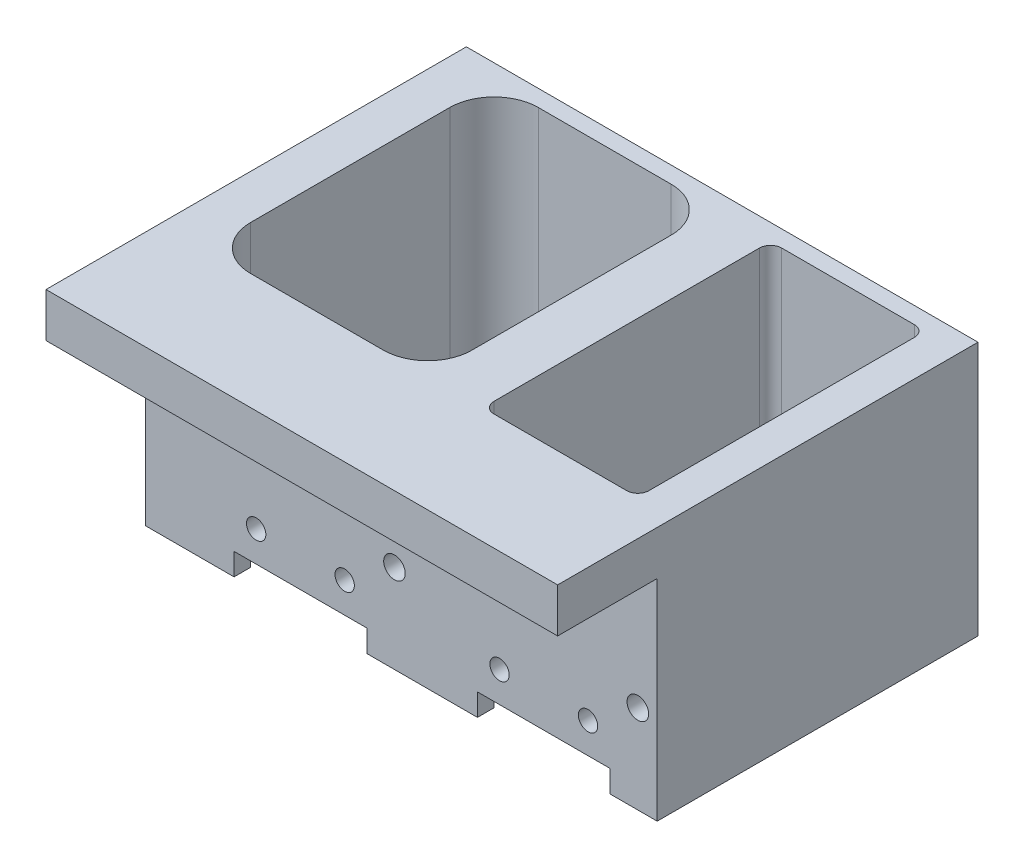
from build123d import *

# Parameters (mm, degrees)
SKETCH1_W                  = 405
SKETCH1_H                  = 295
BOSS_EXTRUDE1_DEPTH        = 53
SKETCH3_OUTSIDE_W          = 507.768
SKETCH3_OUTSIDE_H          = 397.768
SKETCH3_OUTSIDE_W_2        = 369
SKETCH3_OUTSIDE_H_2        = 259
CUT_EXTRUDE2_DEPTH         = 45
MINI_BIN_CUTS_DEPTH        = 46
FILLET1_R                  = 8
SKETCH6_W                  = 259
SKETCH6_H                  = 7
CUT_EXTRUDE5_DEPTH         = 418.533531588
SKETCH8_R                  = 1.75
SKETCH8_R_2                = 1.95
HOLES_LIDS_8_9_12_13_DEPTH = 3
SKETCH9_W                  = 113
SKETCH9_H                  = 46
SKETCH9_W_2                = 199.5
CUT_EXTRUDE6_DEPTH         = 362.718467872
SKETCH10_W                 = 219
SKETCH10_H                 = 46
CUT_EXTRUDE7_DEPTH         = 182.993131739
CUT_EXTRUDE8_REACH         = 121.093
SKETCH11_W                 = 24
SKETCH11_H                 = 4


with BuildPart() as part:
    # Sketch1 → Boss-Extrude1 (new body)
    with BuildSketch(Plane(origin=(0, 0, 0), x_dir=(1, 0, 0), z_dir=(0, 1, 0))):
        Rectangle(SKETCH1_W, SKETCH1_H)
    extrude(amount=BOSS_EXTRUDE1_DEPTH)

    # Sketch3 outside → Cut-Extrude2 (cut)
    with BuildSketch(Plane(origin=(0, 0, 0), x_dir=(-1, 0, 0), z_dir=(0, -1, 0))):
        Rectangle(SKETCH3_OUTSIDE_W, SKETCH3_OUTSIDE_H)
        Rectangle(SKETCH3_OUTSIDE_W_2, SKETCH3_OUTSIDE_H_2, mode=Mode.SUBTRACT)
    extrude(amount=-CUT_EXTRUDE2_DEPTH, mode=Mode.SUBTRACT)

    # Sketch2 → Mini bin cuts (cut)
    with BuildSketch(Plane(origin=(0, 53, 0), x_dir=(1, 0, 0), z_dir=(0, 1, 0))):
        with BuildLine():
            Line((-173.5, -126.5), (-105.5, -126.5))
            ThreePointArc((-105.5, -126.5), (-99.843145751, -124.156854249), (-97.5, -118.5))
            Line((-97.5, -118.5), (-97.5, -49.5))
            ThreePointArc((-97.5, -49.5), (-99.843145751, -43.843145751), (-105.5, -41.5))
            Line((-105.5, -41.5), (-173.5, -41.5))
            ThreePointArc((-173.5, -41.5), (-179.156854249, -43.843145751), (-181.5, -49.5))
            Line((-181.5, -49.5), (-181.5, -118.5))
            ThreePointArc((-181.5, -118.5), (-179.156854249, -124.156854249), (-173.5, -126.5))
        make_face()
        with BuildLine():
            Line((-173.5, -31.5), (-105.5, -31.5))
            ThreePointArc((-105.5, -31.5), (-99.843145751, -29.156854249), (-97.5, -23.5))
            Line((-97.5, -23.5), (-97.5, 40.5))
            ThreePointArc((-97.5, 40.5), (-99.843145751, 46.156854249), (-105.5, 48.5))
            Line((-105.5, 48.5), (-173.5, 48.5))
            ThreePointArc((-173.5, 48.5), (-179.156854249, 46.156854249), (-181.5, 40.5))
            Line((-181.5, 40.5), (-181.5, -23.5))
            ThreePointArc((-181.5, -23.5), (-179.156854249, -29.156854249), (-173.5, -31.5))
        make_face()
        with BuildLine():
            Line((-173.5, 126.5), (-105.5, 126.5))
            ThreePointArc((-105.5, 126.5), (-99.843145751, 124.156854249), (-97.5, 118.5))
            Line((-97.5, 118.5), (-97.5, 66.5))
            ThreePointArc((-97.5, 66.5), (-99.843145751, 60.843145751), (-105.5, 58.5))
            Line((-105.5, 58.5), (-173.5, 58.5))
            ThreePointArc((-173.5, 58.5), (-179.156854249, 60.843145751), (-181.5, 66.5))
            Line((-181.5, 66.5), (-181.5, 118.5))
            ThreePointArc((-181.5, 118.5), (-179.156854249, 124.156854249), (-173.5, 126.5))
        make_face()
        with BuildLine():
            Line((173.5, -126.5), (115.5, -126.5))
            ThreePointArc((115.5, -126.5), (109.843145751, -124.156854249), (107.5, -118.5))
            Line((107.5, -118.5), (107.5, 7.5))
            ThreePointArc((107.5, 7.5), (109.843145751, 13.156854249), (115.5, 15.5))
            Line((115.5, 15.5), (173.5, 15.5))
            ThreePointArc((173.5, 15.5), (179.156854249, 13.156854249), (181.5, 7.5))
            Line((181.5, 7.5), (181.5, -118.5))
            ThreePointArc((181.5, -118.5), (179.156854249, -124.156854249), (173.5, -126.5))
        make_face()
        with BuildLine():
            Line((173.5, 126.5), (107.5, 126.5))
            ThreePointArc((107.5, 126.5), (101.843145751, 124.156854249), (99.5, 118.5))
            Line((99.5, 118.5), (99.5, 33.5))
            ThreePointArc((99.5, 33.5), (101.843145751, 27.843145751), (107.5, 25.5))
            Line((107.5, 25.5), (173.5, 25.5))
            ThreePointArc((173.5, 25.5), (179.156854249, 27.843145751), (181.5, 33.5))
            Line((181.5, 33.5), (181.5, 118.5))
            ThreePointArc((181.5, 118.5), (179.156854249, 124.156854249), (173.5, 126.5))
        make_face()
        with BuildLine():
            Line((81.5, 126.5), (20.5, 126.5))
            ThreePointArc((20.5, 126.5), (14.843145751, 124.156854249), (12.5, 118.5))
            Line((12.5, 118.5), (12.5, -7.5))
            ThreePointArc((12.5, -7.5), (14.843145751, -13.156854249), (20.5, -15.5))
            Line((20.5, -15.5), (81.5, -15.5))
            ThreePointArc((81.5, -15.5), (87.156854249, -13.156854249), (89.5, -7.5))
            Line((89.5, -7.5), (89.5, 118.5))
            ThreePointArc((89.5, 118.5), (87.156854249, 124.156854249), (81.5, 126.5))
        make_face()
        with BuildLine():
            Line((-9.5, 126.5), (-31.5, 126.5))
            ThreePointArc((-31.5, 126.5), (-37.156854249, 124.156854249), (-39.5, 118.5))
            Line((-39.5, 118.5), (-39.5, 11.5))
            ThreePointArc((-39.5, 11.5), (-37.156854249, 5.843145751), (-31.5, 3.5))
            Line((-31.5, 3.5), (-9.5, 3.5))
            ThreePointArc((-9.5, 3.5), (-3.843145751, 5.843145751), (-1.5, 11.5))
            Line((-1.5, 11.5), (-1.5, 118.5))
            ThreePointArc((-1.5, 118.5), (-3.843145751, 124.156854249), (-9.5, 126.5))
        make_face()
        with BuildLine():
            Line((-57.5, 126.5), (-79.5, 126.5))
            ThreePointArc((-79.5, 126.5), (-85.156854249, 124.156854249), (-87.5, 118.5))
            Line((-87.5, 118.5), (-87.5, 11.5))
            ThreePointArc((-87.5, 11.5), (-85.156854249, 5.843145751), (-79.5, 3.5))
            Line((-79.5, 3.5), (-57.5, 3.5))
            ThreePointArc((-57.5, 3.5), (-51.843145751, 5.843145751), (-49.5, 11.5))
            Line((-49.5, 11.5), (-49.5, 118.5))
            ThreePointArc((-49.5, 118.5), (-51.843145751, 124.156854249), (-57.5, 126.5))
        make_face()
        with BuildLine():
            Line((-79.5, -15.5), (-55.5, -15.5))
            ThreePointArc((-55.5, -15.5), (-54.085786438, -16.085786438), (-53.5, -17.5))
            Line((-53.5, -17.5), (-53.5, -65.5))
            ThreePointArc((-53.5, -65.5), (-54.085786438, -66.914213562), (-55.5, -67.5))
            Line((-55.5, -67.5), (-79.5, -67.5))
            ThreePointArc((-79.5, -67.5), (-80.914213562, -66.914213562), (-81.5, -65.5))
            Line((-81.5, -65.5), (-81.5, -17.5))
            ThreePointArc((-81.5, -17.5), (-80.914213562, -16.085786438), (-79.5, -15.5))
        make_face()
        with BuildLine():
            Line((-73.5, -126.5), (-49.5, -126.5))
            ThreePointArc((-49.5, -126.5), (-43.843145751, -124.156854249), (-41.5, -118.5))
            Line((-41.5, -118.5), (-41.5, -82.5))
            ThreePointArc((-41.5, -82.5), (-43.843145751, -76.843145751), (-49.5, -74.5))
            Line((-49.5, -74.5), (-73.5, -74.5))
            ThreePointArc((-73.5, -74.5), (-79.156854249, -76.843145751), (-81.5, -82.5))
            Line((-81.5, -82.5), (-81.5, -118.5))
            ThreePointArc((-81.5, -118.5), (-79.156854249, -124.156854249), (-73.5, -126.5))
        make_face()
        with BuildLine():
            Line((-35.5, -15.5), (-11.5, -15.5))
            ThreePointArc((-11.5, -15.5), (-5.843145751, -17.843145751), (-3.5, -23.5))
            Line((-3.5, -23.5), (-3.5, -59.5))
            ThreePointArc((-3.5, -59.5), (-5.843145751, -65.156854249), (-11.5, -67.5))
            Line((-11.5, -67.5), (-35.5, -67.5))
            ThreePointArc((-35.5, -67.5), (-41.156854249, -65.156854249), (-43.5, -59.5))
            Line((-43.5, -59.5), (-43.5, -23.5))
            ThreePointArc((-43.5, -23.5), (-41.156854249, -17.843145751), (-35.5, -15.5))
        make_face()
        with BuildLine():
            Line((-29.5, -74.5), (-5.5, -74.5))
            ThreePointArc((-5.5, -74.5), (-4.085786438, -75.085786438), (-3.5, -76.5))
            Line((-3.5, -76.5), (-3.5, -124.5))
            ThreePointArc((-3.5, -124.5), (-4.085786438, -125.914213562), (-5.5, -126.5))
            Line((-5.5, -126.5), (-29.5, -126.5))
            ThreePointArc((-29.5, -126.5), (-30.914213562, -125.914213562), (-31.5, -124.5))
            Line((-31.5, -124.5), (-31.5, -76.5))
            ThreePointArc((-31.5, -76.5), (-30.914213562, -75.085786438), (-29.5, -74.5))
        make_face()
        with BuildLine():
            Line((89.5, -126.5), (19.5, -126.5))
            ThreePointArc((19.5, -126.5), (13.843145751, -124.156854249), (11.5, -118.5))
            Line((11.5, -118.5), (11.5, -33.5))
            ThreePointArc((11.5, -33.5), (13.843145751, -27.843145751), (19.5, -25.5))
            Line((19.5, -25.5), (89.5, -25.5))
            ThreePointArc((89.5, -25.5), (95.156854249, -27.843145751), (97.5, -33.5))
            Line((97.5, -33.5), (97.5, -118.5))
            ThreePointArc((97.5, -118.5), (95.156854249, -124.156854249), (89.5, -126.5))
        make_face()
    extrude(amount=-MINI_BIN_CUTS_DEPTH, mode=Mode.SUBTRACT)

    # Fillet1
    fillet1_edges = [part.edges().sort_by_distance(p)[0] for p in [
        (184.5, 22.5, 129.5),
        (184.5, 22.5, -129.5),
        (-184.5, 22.5, -129.5),
        (-184.5, 22.5, 129.5),
    ]]
    fillet(fillet1_edges, radius=FILLET1_R)

    # Sketch6 → Cut-Extrude5 (cut, through all)
    with BuildSketch(Plane.ZY.offset(184.5)):
        with Locations((0, 3.5)):
            Rectangle(SKETCH6_W, SKETCH6_H)
    extrude(amount=-CUT_EXTRUDE5_DEPTH, mode=Mode.SUBTRACT)

    # Sketch8 → Holes Lids 8,9,12,13 (cut)
    with BuildSketch(Plane.XY.offset(129.5)):
        with Locations((-69.5, 16.5)):
            Circle(SKETCH8_R)
        with Locations((-25.5, 16.5)):
            Circle(SKETCH8_R)
        with Locations((46.5, 16.5)):
            Circle(SKETCH8_R)
        with Locations((136.5, 16.5)):
            Circle(SKETCH8_R)
        with Locations((152.5, 16.5)):
            Circle(SKETCH8_R)
        with Locations((62.5, 16.5)):
            Circle(SKETCH8_R)
        with Locations((-9.5, 16.5)):
            Circle(SKETCH8_R)
        with Locations((-53.5, 16.5)):
            Circle(SKETCH8_R)
        with Locations((-44.5, 23)):
            Circle(SKETCH8_R_2)
        with Locations((-0.5, 23)):
            Circle(SKETCH8_R_2)
        with Locations((71.5, 23)):
            Circle(SKETCH8_R_2)
        with Locations((161.5, 23)):
            Circle(SKETCH8_R_2)
    extrude(amount=-HOLES_LIDS_8_9_12_13_DEPTH, mode=Mode.SUBTRACT)

    # Sketch9 → Cut-Extrude6 (cut, through all)
    with BuildSketch(Plane.XY.offset(147.5)):
        with Locations((-146, 30)):
            Rectangle(SKETCH9_W, SKETCH9_H)
        with Locations((102.75, 30)):
            Rectangle(SKETCH9_W_2, SKETCH9_H)
    extrude(amount=-CUT_EXTRUDE6_DEPTH, mode=Mode.SUBTRACT)

    # Sketch10 → Cut-Extrude7 (cut, through all)
    with BuildSketch(Plane(origin=(3, 0, 0), x_dir=(0, 0, -1), z_dir=(1, 0, 0))):
        with Locations((38, 30)):
            Rectangle(SKETCH10_W, SKETCH10_H)
    extrude(amount=-CUT_EXTRUDE7_DEPTH, mode=Mode.SUBTRACT)

    # Cut-Extrude8: up to this face of the body (flat: up to its plane)
    cut_extrude8_end = Plane(part.part.faces().sort_by_distance((-61.5, 30.239473231, 126.5))[0])
    # Sketch11 → Cut-Extrude8 (cut, up to the picked face)
    with BuildSketch(Plane.XY.offset(129.5), mode=Mode.PRIVATE) as cut_extrude8_sk1:
        with Locations((-61.5, 9)):
            Rectangle(SKETCH11_W, SKETCH11_H)
    cut_extrude8_tool1 = split(extrude(cut_extrude8_sk1.sketch, amount=-CUT_EXTRUDE8_REACH, mode=Mode.PRIVATE), bisect_by=cut_extrude8_end, keep=Keep.BOTH, mode=Mode.PRIVATE)
    # Sketch11 → Cut-Extrude8 (cut, up to the picked face)
    with BuildSketch(Plane.XY.offset(129.5), mode=Mode.PRIVATE) as cut_extrude8_sk2:
        with Locations((-17.5, 9)):
            Rectangle(SKETCH11_W, SKETCH11_H)
    cut_extrude8_tool2 = split(extrude(cut_extrude8_sk2.sketch, amount=-CUT_EXTRUDE8_REACH, mode=Mode.PRIVATE), bisect_by=cut_extrude8_end, keep=Keep.BOTH, mode=Mode.PRIVATE)
    add(cut_extrude8_tool1.solids().sort_by(Axis((-61.5, 9, 129.5), (0, 0, -1)))[0], mode=Mode.SUBTRACT)
    add(cut_extrude8_tool2.solids().sort_by(Axis((-17.5, 9, 129.5), (0, 0, -1)))[0], mode=Mode.SUBTRACT)


solid = part.part
